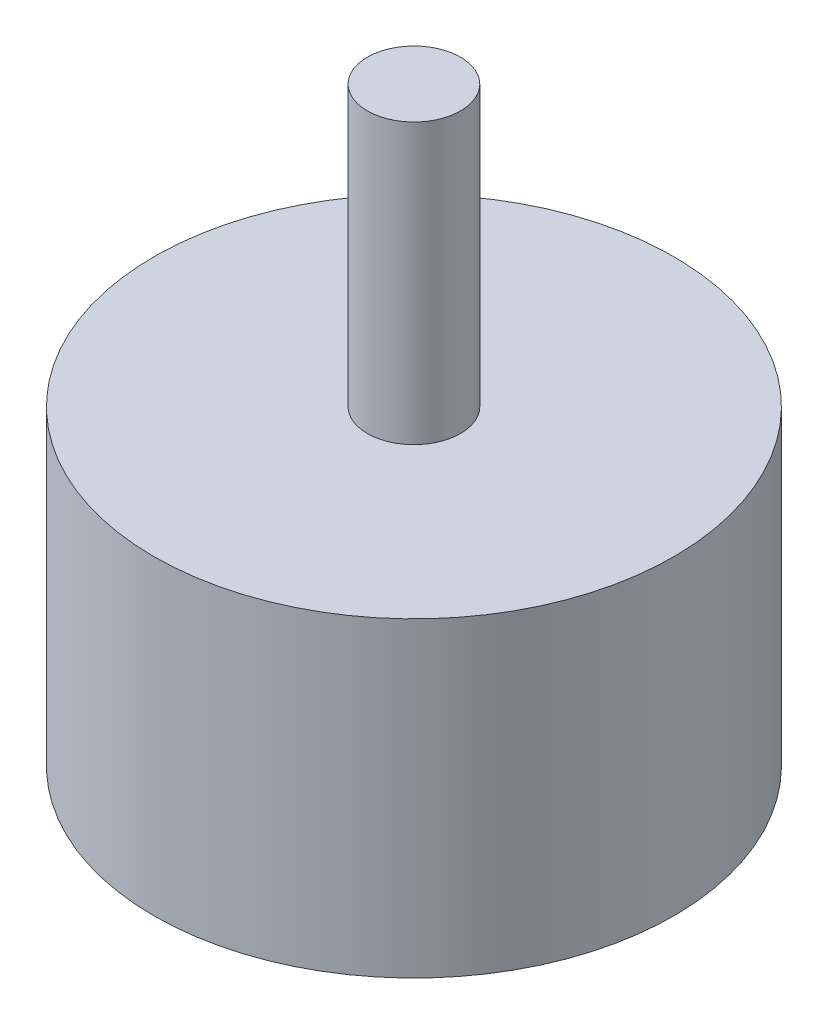
from build123d import *

# Parameters (mm, degrees)
SKETCH1_R           = 13.95
BOSS_EXTRUDE1_DEPTH = 16.7
SKETCH2_R           = 2.5
BOSS_EXTRUDE2_DEPTH = 15


with BuildPart() as part:
    # Sketch1 → Boss-Extrude1 (new body)
    with BuildSketch(Plane(origin=(0, 0, 0), x_dir=(1, 0, 0), z_dir=(0, 1, 0))):
        with Locations(Location((0, 0, 0), (0, 0, 270))):
            Circle(SKETCH1_R)
    extrude(amount=BOSS_EXTRUDE1_DEPTH)

    # Sketch2 → Boss-Extrude2 (add)
    with BuildSketch(Plane(origin=(0, 16.7, 0), x_dir=(1, 0, 0), z_dir=(0, 1, 0))):
        with Locations(Location((0, 0, 0), (0, 0, 270))):
            Circle(SKETCH2_R)
    extrude(amount=BOSS_EXTRUDE2_DEPTH)


solid = part.part
